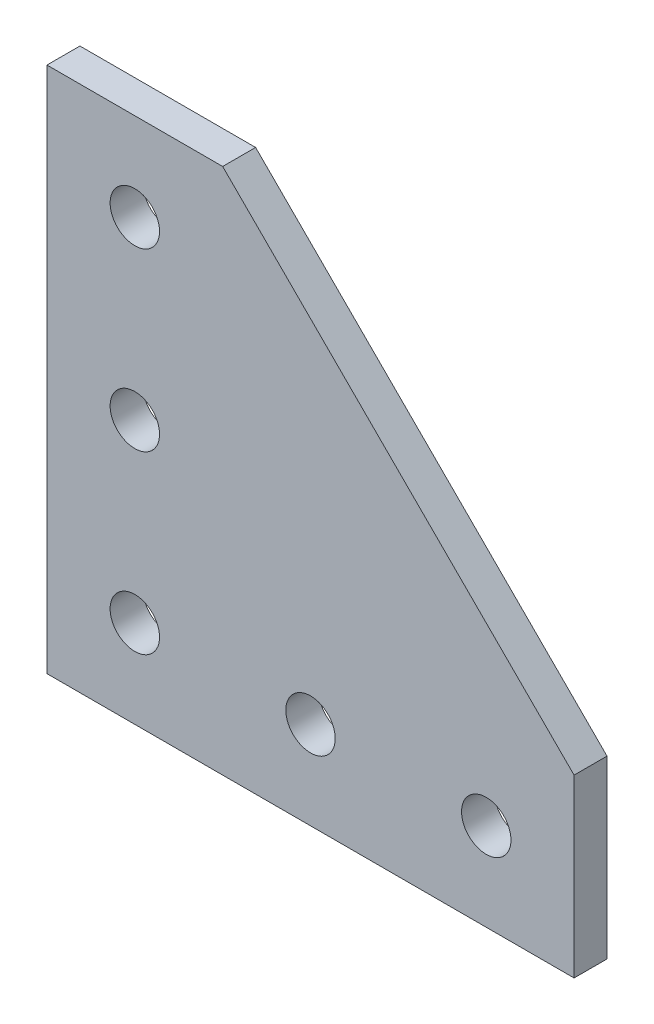
from build123d import *

# Parameters (mm, degrees)
SKETCH1_R               = 3.2639
BOSS_EXTRUDE1_DEPTH     = 2.38125
F_1_4_CLEARANCE_HOLE1_D = 7.14248


with BuildPart() as part:
    # Sketch1 → Boss-Extrude1 (new, symmetric)
    with BuildSketch(Plane.XY):
        Polygon((0, 0), (0, 76.2), (25.4, 76.2), (76.2, 25.4), (76.2, 0), align=None)
        with Locations(Location((12.7, 12.7, 0), (0, 0, 180))):
            Circle(SKETCH1_R, mode=Mode.SUBTRACT)
        with Locations(Location((38.1, 12.7, 0), (0, 0, 180))):
            Circle(SKETCH1_R, mode=Mode.SUBTRACT)
        with Locations(Location((63.5, 12.7, 0), (0, 0, 180))):
            Circle(SKETCH1_R, mode=Mode.SUBTRACT)
        with Locations(Location((12.7, 38.1, 0), (0, 0, 180))):
            Circle(SKETCH1_R, mode=Mode.SUBTRACT)
        with Locations(Location((12.7, 63.5, 0), (0, 0, 180))):
            Circle(SKETCH1_R, mode=Mode.SUBTRACT)
    extrude(amount=BOSS_EXTRUDE1_DEPTH, both=True)

    # 1/4 Clearance Hole1 (through all)
    with Locations(Plane.XY.offset(2.38125)):
        with Locations((12.7, 63.5), (12.7, 38.1), (12.7, 12.7), (38.1, 12.7), (63.5, 12.7)):
            Hole(F_1_4_CLEARANCE_HOLE1_D / 2)


solid = part.part
